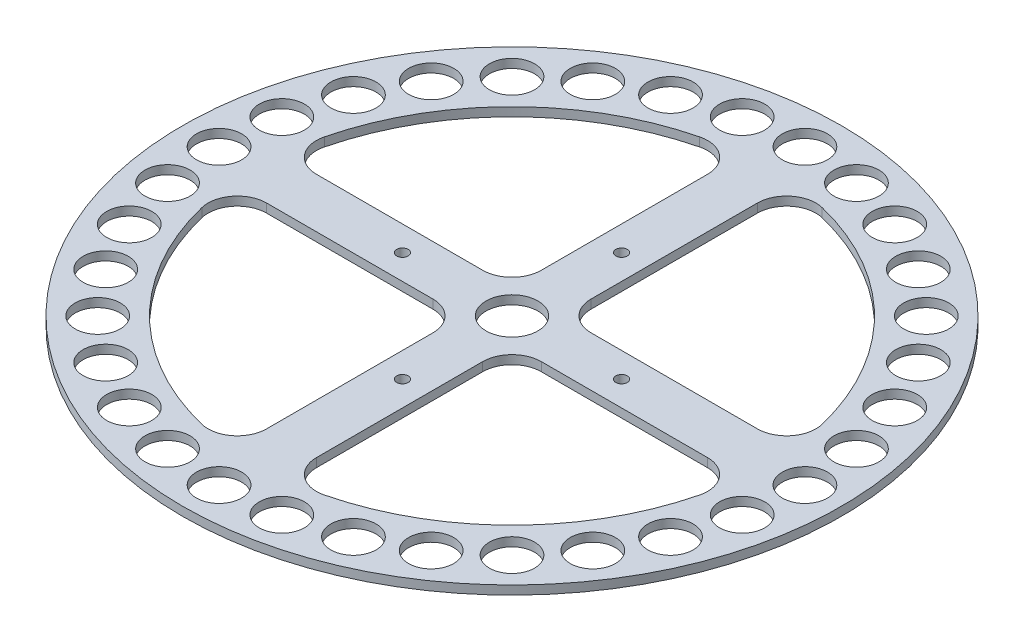
from build123d import *

# Parameters (mm, degrees)
SKETCH1_R               = 142.875
SKETCH1_R_2             = 11.25
BOSS_EXTRUDE2_DEPTH     = 3.81
SKETCH2_R               = 9.779
CUT_EXTRUDE1_DEPTH      = 203.091680556
CUT_EXTRUDE2_DEPTH      = 203.091680556
CUT_EXTRUDE2_DEPTH_BACK = 203.091680556
FILLET1_R               = 12.7
CIRPATTERN1_COUNT       = 32
SKETCH5_R               = 2.5
CUT_EXTRUDE3_DEPTH      = 203.091680556


with BuildPart() as part:
    # Sketch1 → Boss-Extrude2 (new body)
    with BuildSketch(Plane(origin=(0, 0, 0), x_dir=(1, 0, 0), z_dir=(0, 1, 0))):
        with Locations(Location((0, 0, 0), (0, 0, 270))):
            Circle(SKETCH1_R)
        with Locations(Location((0, 0, 0), (0, 0, 270))):
            Circle(SKETCH1_R_2, mode=Mode.SUBTRACT)
    extrude(amount=-BOSS_EXTRUDE2_DEPTH)

    # Sketch2 → Cut-Extrude1 (cut, through all)
    with BuildSketch(Plane(origin=(0, 0, 0), x_dir=(1, 0, 0), z_dir=(0, 1, 0))):
        with Locations(Location((-127, 0, 0), (0, 0, 270))):
            Circle(SKETCH2_R)
    cut_extrude1 = extrude(amount=-CUT_EXTRUDE1_DEPTH, mode=Mode.SUBTRACT)

    # Sketch4 → Cut-Extrude2 (cut, two sides: drawn at the far end of the back side and taken through both)
    with BuildSketch(Plane(origin=(0, 0, 0), x_dir=(1, 0, 0), z_dir=(0, 1, 0)).offset(-CUT_EXTRUDE2_DEPTH_BACK)):
        with BuildLine():
            ThreePointArc((10.795, -110.59942857), (78.577241059, -78.577241059), (110.59942857, -10.795))
            Line((110.59942857, -10.795), (14.330567107, -10.795))
            Line((14.330567107, -10.795), (10.795, -10.795))
            Line((10.795, -10.795), (10.795, -14.276272178))
            Line((10.795, -14.276272178), (10.795, -110.59942857))
        make_face()
        with BuildLine():
            ThreePointArc((110.59942857, 10.795), (78.577241059, 78.577241059), (10.795, 110.59942857))
            Line((10.795, 110.59942857), (10.795, 13.38498083))
            Line((10.795, 13.38498083), (10.795, 10.795))
            Line((10.795, 10.795), (14.557306927, 10.795))
            Line((14.557306927, 10.795), (110.59942857, 10.795))
        make_face()
        with BuildLine():
            Line((-10.795, 10.795), (-10.795, 16.346811669))
            Line((-10.795, 16.346811669), (-10.795, 110.59942857))
            ThreePointArc((-10.795, 110.59942857), (-78.577241059, 78.577241059), (-110.59942857, 10.795))
            Line((-110.59942857, 10.795), (-13.320463431, 10.795))
            Line((-13.320463431, 10.795), (-10.795, 10.795))
        make_face()
        with BuildLine():
            Line((-15.550882255, -10.795), (-110.59942857, -10.795))
            ThreePointArc((-110.59942857, -10.795), (-78.577241059, -78.577241059), (-10.795, -110.59942857))
            Line((-10.795, -110.59942857), (-10.795, -14.068746807))
            Line((-10.795, -14.068746807), (-10.795, -10.795))
            Line((-10.795, -10.795), (-15.550882255, -10.795))
        make_face()
    extrude(amount=CUT_EXTRUDE2_DEPTH + CUT_EXTRUDE2_DEPTH_BACK, mode=Mode.SUBTRACT)

    # Fillet1
    fillet1_edges = [part.edges().sort_by_distance(p)[0] for p in [
        (-110.59942857, -1.905, 10.795),
        (-10.795, -1.905, 10.795),
        (-10.795, -1.905, 110.59942857),
        (-10.795, -1.905, -110.59942857),
        (-10.795, -1.905, -10.795),
        (-110.59942857, -1.905, -10.795),
        (110.59942857, -1.905, -10.795),
        (10.795, -1.905, -10.795),
        (10.795, -1.905, -110.59942857),
        (10.795, -1.905, 110.59942857),
        (10.795, -1.905, 10.795),
        (110.59942857, -1.905, 10.795),
    ]]
    fillet(fillet1_edges, radius=FILLET1_R)

    # CirPattern1: Cut-Extrude1 ×32 about axis
    cirpattern1_axis = Axis((0, 0, 0), (0, 1, 0))
    for i in range(1, CIRPATTERN1_COUNT):
        add(cut_extrude1.rotate(cirpattern1_axis, i * 360 / CIRPATTERN1_COUNT), mode=Mode.SUBTRACT)

    # Sketch5 → Cut-Extrude3 (cut, through all)
    with BuildSketch(Plane(origin=(0, 0, 0), x_dir=(1, 0, 0), z_dir=(0, 1, 0))):
        with Locations(Location((0, 47.5, 0), (0, 0, 270))):
            Circle(SKETCH5_R)
        with Locations(Location((47.5, 0, 0), (0, 0, 270))):
            Circle(SKETCH5_R)
        with Locations(Location((0, -47.5, 0), (0, 0, 270))):
            Circle(SKETCH5_R)
        with Locations(Location((-47.5, 0, 0), (0, 0, 270))):
            Circle(SKETCH5_R)
    extrude(amount=-CUT_EXTRUDE3_DEPTH, mode=Mode.SUBTRACT)


solid = part.part
